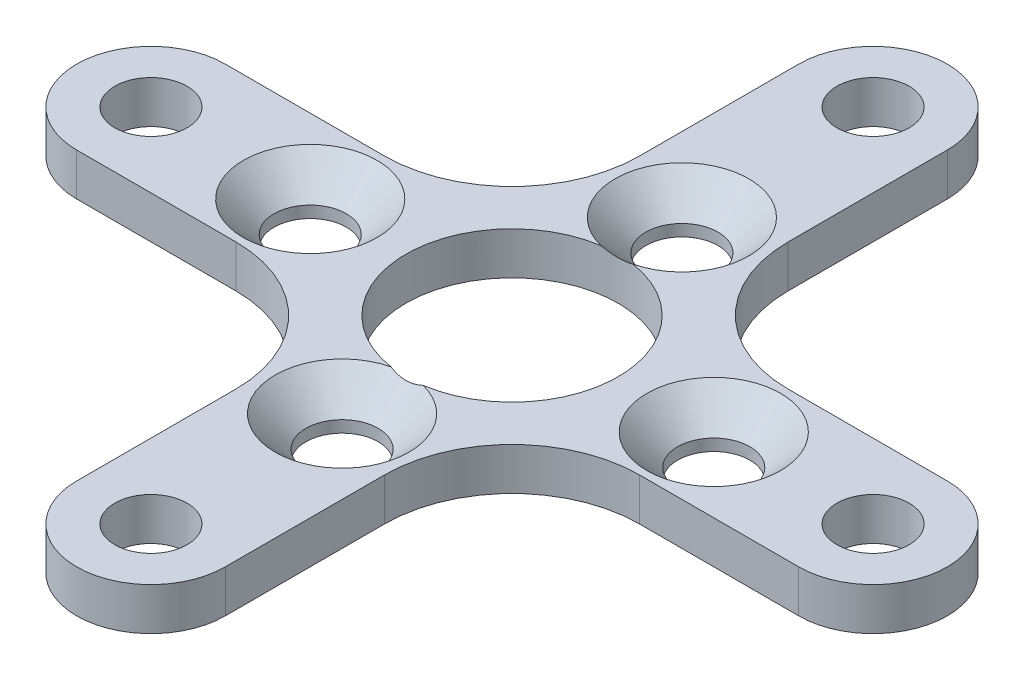
from build123d import *

# Parameters (mm, degrees)
SKETCH1_R                                      = 5
BOSS_EXTRUDE1_DEPTH                            = 2
M3_CLEARANCE_HOLE1_D                           = 3.4
CSK_FOR_M3_FLAT_HEAD_MACHINE_SCREW3_AT_2_COUNT = 2
CSK_FOR_M3_FLAT_HEAD_MACHINE_SCREW3_AT_2_PITCH = 12.419742348
CSK_FOR_M3_FLAT_HEAD_MACHINE_SCREW3_AT_3_COUNT = 2
CSK_FOR_M3_FLAT_HEAD_MACHINE_SCREW3_AT_3_PITCH = 16
CSK_FOR_M3_FLAT_HEAD_MACHINE_SCREW3_AT_4_COUNT = 2
CSK_FOR_M3_FLAT_HEAD_MACHINE_SCREW3_AT_4_PITCH = 12.419742348


with BuildPart() as part:
    # Sketch1 → Boss-Extrude1 (new body)
    with BuildSketch(Plane(origin=(0, 0, 0), x_dir=(1, 0, 0), z_dir=(0, 1, 0))):
        with BuildLine():
            Line((3.5, 9.5), (3.5, 17))
            ThreePointArc((3.5, 17), (0, 20.5), (-3.5, 17))
            Line((-3.5, 17), (-3.5, 9.5))
            ThreePointArc((-3.5, 9.5), (-5.257359313, 5.257359313), (-9.5, 3.5))
            Line((-9.5, 3.5), (-17, 3.5))
            ThreePointArc((-17, 3.5), (-20.5, 0), (-17, -3.5))
            Line((-17, -3.5), (-9.5, -3.5))
            ThreePointArc((-9.5, -3.5), (-5.257359313, -5.257359313), (-3.5, -9.5))
            Line((-3.5, -9.5), (-3.5, -17))
            ThreePointArc((-3.5, -17), (0, -20.5), (3.5, -17))
            Line((3.5, -17), (3.5, -9.5))
            ThreePointArc((3.5, -9.5), (5.257359313, -5.257359313), (9.5, -3.5))
            Line((9.5, -3.5), (17, -3.5))
            ThreePointArc((17, -3.5), (20.5, 0), (17, 3.5))
            Line((17, 3.5), (9.5, 3.5))
            ThreePointArc((9.5, 3.5), (5.257359313, 5.257359313), (3.5, 9.5))
        make_face()
        with Locations(Location((0, 0, 0), (0, 0, 270))):
            Circle(SKETCH1_R, mode=Mode.SUBTRACT)
    extrude(amount=BOSS_EXTRUDE1_DEPTH)

    # M3 Clearance Hole1 (through all)
    with Locations(Plane(origin=(0, 2, 0), x_dir=(1, 0, 0), z_dir=(0, 1, 0))):
        with Locations((0, 17), (-17, 0), (17, 0), (0, -17)):
            Hole(M3_CLEARANCE_HOLE1_D / 2)

    # Sketch8 → CSK for M3 Flat Head Machine Screw3 (revolve, cut)
    with BuildSketch(Plane(origin=(0, 2, -8), x_dir=(0, 0, 1), z_dir=(1, 0, 0))):
        Polygon((0, 0), (0, 2), (1.7, 2), (1.7, 1.45), (3.15, 0), align=None)
    csk_for_m3_flat_head_machine_screw3 = revolve(axis=Axis((0, 8.35, -8), (0, -1, 0)), mode=Mode.SUBTRACT)

    # CSK for M3 Flat Head Machine Screw3 at 2: CSK for M3 Flat Head Machine Screw3 ×2
    with Locations(*[Vector(-0.7649111981170509, 0, 0.6441357457827798) * (i * CSK_FOR_M3_FLAT_HEAD_MACHINE_SCREW3_AT_2_PITCH) for i in range(1, CSK_FOR_M3_FLAT_HEAD_MACHINE_SCREW3_AT_2_COUNT)]):
        add(csk_for_m3_flat_head_machine_screw3, mode=Mode.SUBTRACT)

    # CSK for M3 Flat Head Machine Screw3 at 3: CSK for M3 Flat Head Machine Screw3 ×2
    with Locations(*[(0, 0, i * CSK_FOR_M3_FLAT_HEAD_MACHINE_SCREW3_AT_3_PITCH) for i in range(1, CSK_FOR_M3_FLAT_HEAD_MACHINE_SCREW3_AT_3_COUNT)]):
        add(csk_for_m3_flat_head_machine_screw3, mode=Mode.SUBTRACT)

    # CSK for M3 Flat Head Machine Screw3 at 4: CSK for M3 Flat Head Machine Screw3 ×2
    with Locations(*[Vector(0.7649111981170508, 0, 0.6441357457827798) * (i * CSK_FOR_M3_FLAT_HEAD_MACHINE_SCREW3_AT_4_PITCH) for i in range(1, CSK_FOR_M3_FLAT_HEAD_MACHINE_SCREW3_AT_4_COUNT)]):
        add(csk_for_m3_flat_head_machine_screw3, mode=Mode.SUBTRACT)


solid = part.part
